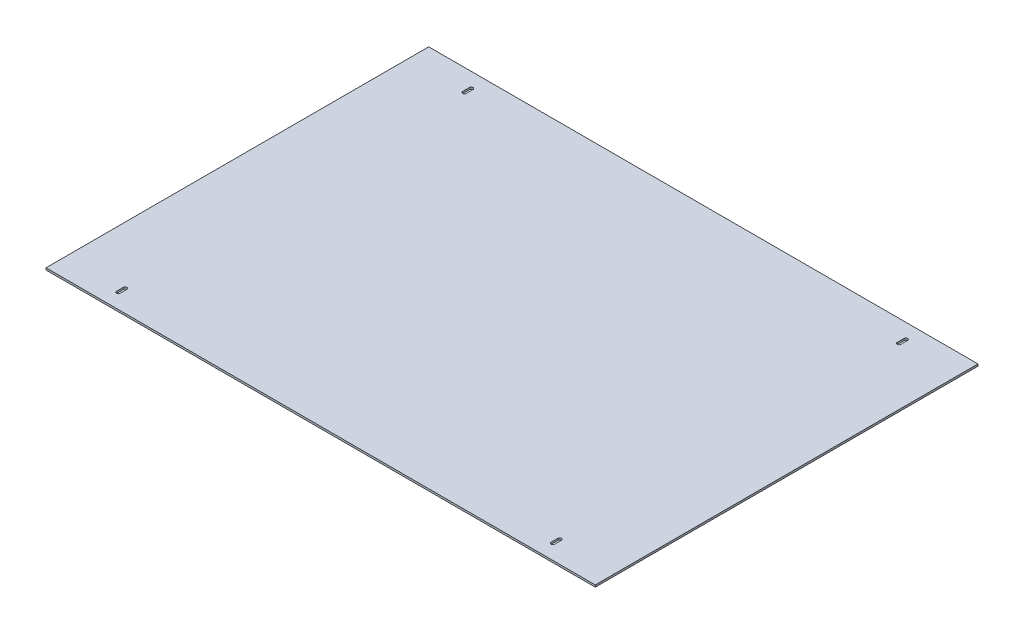
from build123d import *

# Parameters (mm, degrees)
SKETCH1_W           = 706.247
SKETCH1_H           = 492.125
BOSS_EXTRUDE1_DEPTH = 2.54
CUT_EXTRUDE2_DEPTH  = 431.406100977


with BuildPart() as part:
    # Sketch1 → Boss-Extrude1 (new body)
    with BuildSketch(Plane(origin=(0, 0, 0), x_dir=(1, 0, 0), z_dir=(0, 1, 0))):
        Rectangle(SKETCH1_W, SKETCH1_H)
    extrude(amount=BOSS_EXTRUDE1_DEPTH)

    # Sketch6 → Cut-Extrude2 (cut, through all)
    with BuildSketch(Plane(origin=(0, 2.54, 0), x_dir=(1, 0, 0), z_dir=(0, 1, 0))):
        with BuildLine():
            Line((277.1521, 218.1225), (277.1521, 227.0125))
            ThreePointArc((277.1521, 227.0125), (279.4, 229.2604), (281.6479, 227.0125))
            Line((281.6479, 227.0125), (281.6479, 218.1225))
            ThreePointArc((281.6479, 218.1225), (279.4, 215.8746), (277.1521, 218.1225))
        make_face()
        with BuildLine():
            Line((-277.1521, 218.1225), (-277.1521, 227.0125))
            ThreePointArc((-277.1521, 227.0125), (-279.4, 229.2604), (-281.6479, 227.0125))
            Line((-281.6479, 227.0125), (-281.6479, 218.1225))
            ThreePointArc((-281.6479, 218.1225), (-279.4, 215.8746), (-277.1521, 218.1225))
        make_face()
        with BuildLine():
            Line((277.1521, -218.1225), (277.1521, -227.0125))
            ThreePointArc((277.1521, -227.0125), (279.4, -229.2604), (281.6479, -227.0125))
            Line((281.6479, -227.0125), (281.6479, -218.1225))
            ThreePointArc((281.6479, -218.1225), (279.4, -215.8746), (277.1521, -218.1225))
        make_face()
        with BuildLine():
            Line((-277.1521, -218.1225), (-277.1521, -227.0125))
            ThreePointArc((-277.1521, -227.0125), (-279.4, -229.2604), (-281.6479, -227.0125))
            Line((-281.6479, -227.0125), (-281.6479, -218.1225))
            ThreePointArc((-281.6479, -218.1225), (-279.4, -215.8746), (-277.1521, -218.1225))
        make_face()
    extrude(amount=-CUT_EXTRUDE2_DEPTH, mode=Mode.SUBTRACT)


solid = part.part
